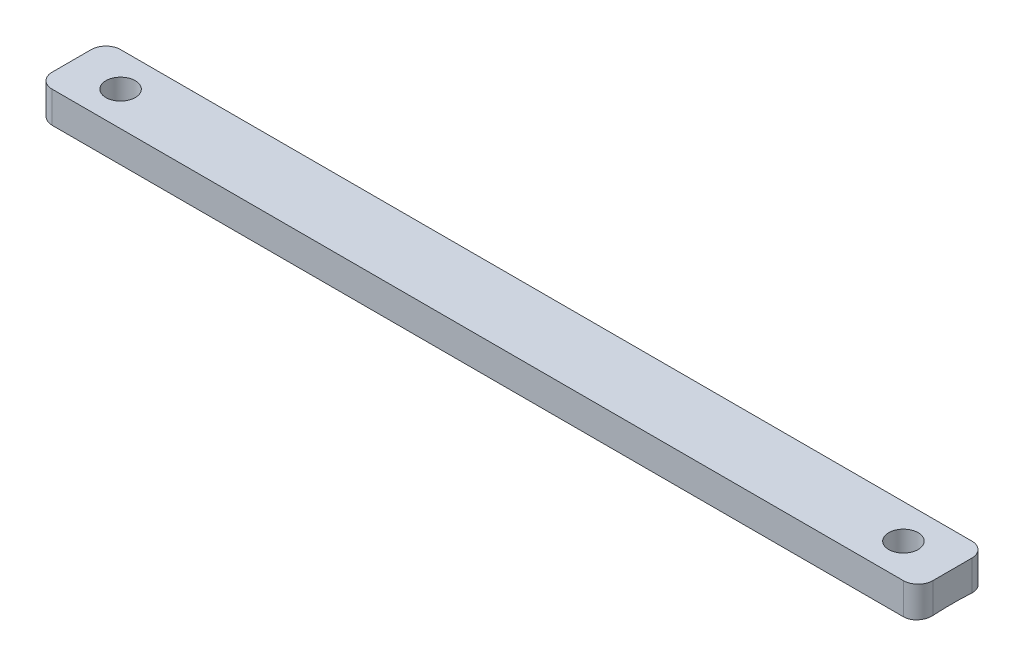
from build123d import *

# Parameters (mm, degrees)
SKETCH1_W               = 90
SKETCH1_H               = 7
SKETCH1_R               = 1.5
BOSS_EXTRUDE1_DEPTH     = 3.2
CUT_EXTRUDE1_DEPTH      = 91.328511556
CUT_EXTRUDE1_DEPTH_BACK = 91.328511556
FILLET1_R               = 1.5


with BuildPart() as part:
    # Sketch1 → Boss-Extrude1 (new body)
    with BuildSketch(Plane(origin=(0, 0, 0), x_dir=(1, 0, 0), z_dir=(0, 1, 0))):
        with Locations((45, 3.5)):
            Rectangle(SKETCH1_W, SKETCH1_H)
        with Locations(Location((5, 3.5, 0), (0, 0, 270))):
            Circle(SKETCH1_R, mode=Mode.SUBTRACT)
        with Locations(Location((85, 3.5, 0), (0, 0, 270))):
            Circle(SKETCH1_R, mode=Mode.SUBTRACT)
    extrude(amount=BOSS_EXTRUDE1_DEPTH)

    # Sketch2 → Cut-Extrude1 (cut, two sides: drawn at the far end of the back side and taken through both)
    with BuildSketch(Plane(origin=(90, 0, 0), x_dir=(0, 0, -1), z_dir=(1, 0, 0)).offset(-CUT_EXTRUDE1_DEPTH_BACK)):
        with BuildLine():
            Line((0, 0), (7, 0))
            ThreePointArc((7, 0), (3.5, 0.165912527), (0, 0))
        make_face()
    extrude(amount=CUT_EXTRUDE1_DEPTH + CUT_EXTRUDE1_DEPTH_BACK, mode=Mode.SUBTRACT)

    # Fillet1
    fillet1_edges = [part.edges().sort_by_distance(p)[0] for p in [
        (0, 1.6, -7),
        (90, 1.6, -7),
        (90, 1.6, 0),
        (0, 1.6, 0),
    ]]
    fillet(fillet1_edges, radius=FILLET1_R)


solid = part.part
